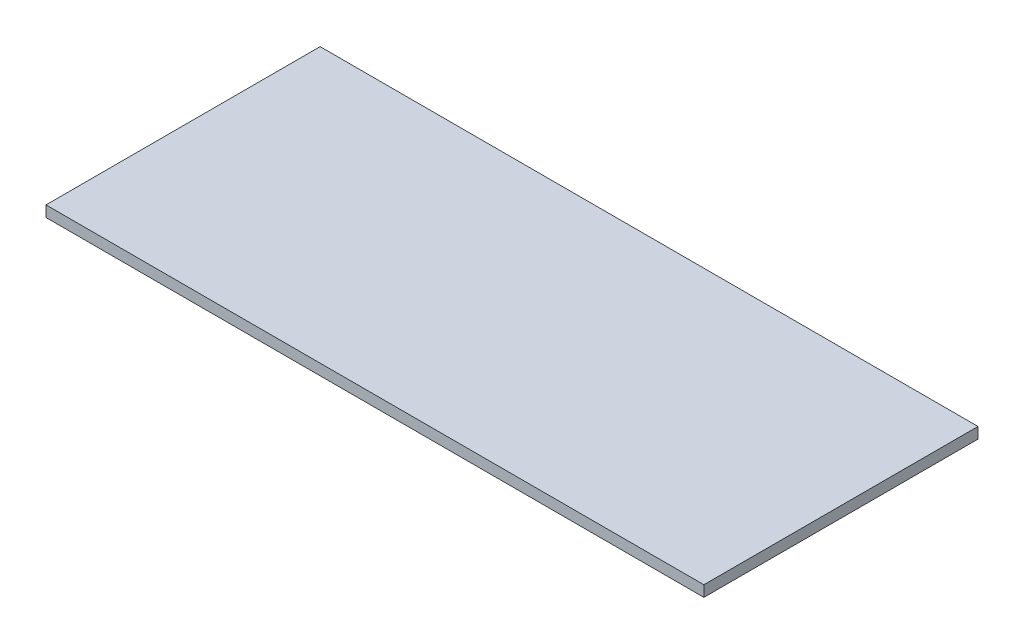
from build123d import *

# Parameters (mm, degrees)
SKETCH1_W           = 480
SKETCH1_H           = 8
BOSS_EXTRUDE1_DEPTH = 200


with BuildPart() as part:
    # Sketch1 → Boss-Extrude1 (new body)
    with BuildSketch(Plane.XY):
        Rectangle(SKETCH1_W, SKETCH1_H)
    extrude(amount=BOSS_EXTRUDE1_DEPTH)


solid = part.part
